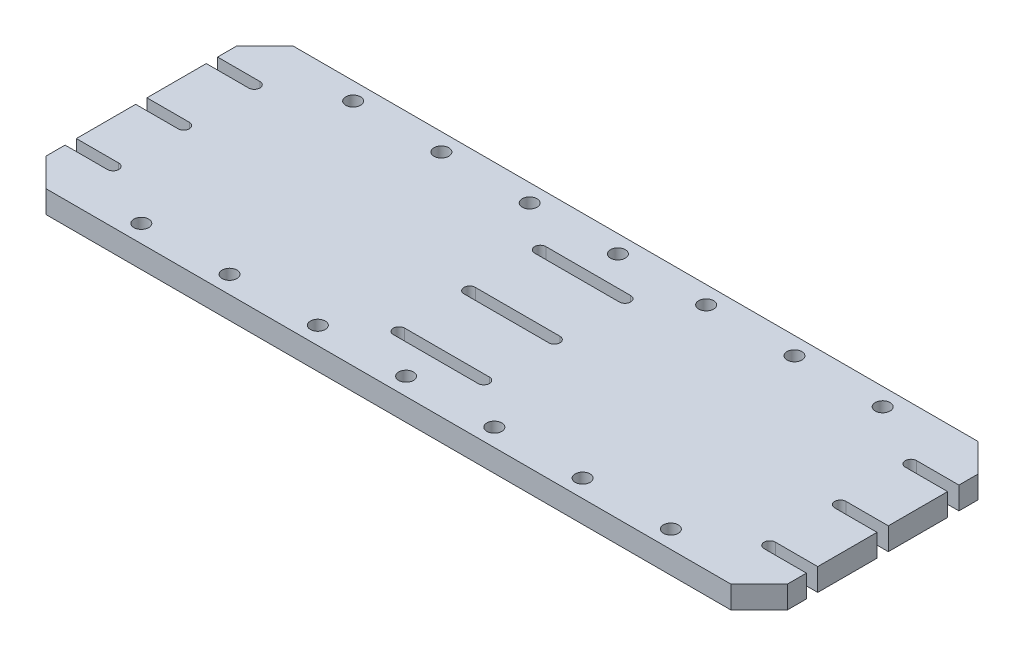
from build123d import *

# Parameters (mm, degrees)
SKETCH1_W                   = 210
SKETCH1_H                   = 70
BOSS_EXTRUDE1_DEPTH         = 6.35
CUT_EXTRUDE1_DEPTH          = 111.861726939
LPATTERN1_COUNT             = 4
LPATTERN1_PITCH             = 20
LPATTERN1_COUNT_DIR2        = 4
LPATTERN1_PITCH_DIR2        = 20
LPATTERN2_COUNT             = 2
LPATTERN2_PITCH             = 105
LPATTERN2_COPY_1_DEPTH      = 111.861726939
LPATTERN2_COPY_2_DEPTH      = 111.861726939
LPATTERN2_COPY_3_DEPTH      = 111.861726939
LPATTERN2_COPY_4_DEPTH      = 111.861726939
LPATTERN2_COPY_5_DEPTH      = 111.861726939
LPATTERN2_COPY_6_DEPTH      = 111.861726939
LPATTERN2_COPY_7_DEPTH      = 111.861726939
LPATTERN2_COPY_8_DEPTH      = 111.861726939
LPATTERN2_COPY_9_DEPTH      = 111.861726939
LPATTERN2_COPY_10_DEPTH     = 111.861726939
LPATTERN2_COPY_11_DEPTH     = 111.861726939
LPATTERN2_COPY_12_DEPTH     = 111.861726939
LPATTERN2_COPY_13_DEPTH     = 111.861726939
LPATTERN2_COPY_14_DEPTH     = 111.861726939
LPATTERN2_COPY_15_DEPTH     = 111.861726939
LPATTERN2_COL_COUNT         = 2
LPATTERN2_COL_PITCH         = 105
LPATTERN2_COL_COPY_1_DEPTH  = 111.861726939
LPATTERN2_COL_COPY_2_DEPTH  = 111.861726939
LPATTERN2_COL_COPY_3_DEPTH  = 111.861726939
LPATTERN2_COL_COPY_4_DEPTH  = 111.861726939
LPATTERN2_COL_COPY_5_DEPTH  = 111.861726939
LPATTERN2_COL_COPY_6_DEPTH  = 111.861726939
LPATTERN2_COL_COPY_7_DEPTH  = 111.861726939
LPATTERN2_COL_COPY_8_DEPTH  = 111.861726939
LPATTERN2_COL_COPY_9_DEPTH  = 111.861726939
LPATTERN2_COL_COPY_10_DEPTH = 111.861726939
LPATTERN2_COL_COPY_11_DEPTH = 111.861726939
LPATTERN2_COL_COPY_12_DEPTH = 111.861726939
LPATTERN2_COL_COPY_13_DEPTH = 111.861726939
LPATTERN2_COL_COPY_14_DEPTH = 111.861726939
LPATTERN2_COL_COPY_15_DEPTH = 111.861726939
SKETCH4_R                   = 2.1
CUT_EXTRUDE2_DEPTH          = 111.861726939
LPATTERN3_COUNT             = 4
LPATTERN3_PITCH             = 25
LPATTERN3_COL_COUNT         = 4
LPATTERN3_COL_PITCH         = 25
CHAMFER1_SIZE               = 8


with BuildPart() as part:
    # Sketch1 → Boss-Extrude1 (new body)
    with BuildSketch(Plane(origin=(0, 0, 0), x_dir=(1, 0, 0), z_dir=(0, 1, 0))):
        Rectangle(SKETCH1_W, SKETCH1_H)
    extrude(amount=BOSS_EXTRUDE1_DEPTH)

    # Sketch3 → Cut-Extrude1 (cut, symmetric)
    with BuildSketch(Plane(origin=(0, 6.35, 0), x_dir=(1, 0, 0), z_dir=(0, 1, 0))):
        with BuildLine():
            Line((12, -1.6), (-12, -1.6))
            ThreePointArc((-12, -1.6), (-13.6, 0), (-12, 1.6))
            Line((-12, 1.6), (12, 1.6))
            ThreePointArc((12, 1.6), (13.6, 0), (12, -1.6))
        make_face()
    cut_extrude1 = extrude(amount=CUT_EXTRUDE1_DEPTH, both=True, mode=Mode.SUBTRACT)

    # LPattern1: Cut-Extrude1 4 × 4
    with Locations(*[Vector(0, 0, 1) * (i * LPATTERN1_PITCH) + Vector(0, 0, -1) * (j * LPATTERN1_PITCH_DIR2) for i in range(LPATTERN1_COUNT) for j in range(LPATTERN1_COUNT_DIR2) if (i, j) != (0, 0)]):
        add(cut_extrude1, mode=Mode.SUBTRACT)

    # LPattern2: Cut-Extrude1 ×2
    with Locations(*[(i * LPATTERN2_PITCH, 0, 0) for i in range(1, LPATTERN2_COUNT)]):
        add(cut_extrude1, mode=Mode.SUBTRACT)

    # LPattern2 copy 1 sketch → LPattern2 copy 1 (cut, symmetric)
    with BuildSketch(Plane(origin=(105, 6.35, -20), x_dir=(1, 0, 0), z_dir=(0, 1, 0))):
        with BuildLine():
            Line((12, -1.6), (-12, -1.6))
            ThreePointArc((-12, -1.6), (-13.6, 0), (-12, 1.6))
            Line((-12, 1.6), (12, 1.6))
            ThreePointArc((12, 1.6), (13.6, 0), (12, -1.6))
        make_face()
    extrude(amount=LPATTERN2_COPY_1_DEPTH, both=True, mode=Mode.SUBTRACT)

    # LPattern2 copy 2 sketch → LPattern2 copy 2 (cut, symmetric)
    with BuildSketch(Plane(origin=(105, 6.35, -40), x_dir=(1, 0, 0), z_dir=(0, 1, 0))):
        with BuildLine():
            Line((12, -1.6), (-12, -1.6))
            ThreePointArc((-12, -1.6), (-13.6, 0), (-12, 1.6))
            Line((-12, 1.6), (12, 1.6))
            ThreePointArc((12, 1.6), (13.6, 0), (12, -1.6))
        make_face()
    extrude(amount=LPATTERN2_COPY_2_DEPTH, both=True, mode=Mode.SUBTRACT)

    # LPattern2 copy 3 sketch → LPattern2 copy 3 (cut, symmetric)
    with BuildSketch(Plane(origin=(105, 6.35, -60), x_dir=(1, 0, 0), z_dir=(0, 1, 0))):
        with BuildLine():
            Line((12, -1.6), (-12, -1.6))
            ThreePointArc((-12, -1.6), (-13.6, 0), (-12, 1.6))
            Line((-12, 1.6), (12, 1.6))
            ThreePointArc((12, 1.6), (13.6, 0), (12, -1.6))
        make_face()
    extrude(amount=LPATTERN2_COPY_3_DEPTH, both=True, mode=Mode.SUBTRACT)

    # LPattern2 copy 4 sketch → LPattern2 copy 4 (cut, symmetric)
    with BuildSketch(Plane(origin=(105, 6.35, 20), x_dir=(1, 0, 0), z_dir=(0, 1, 0))):
        with BuildLine():
            Line((12, -1.6), (-12, -1.6))
            ThreePointArc((-12, -1.6), (-13.6, 0), (-12, 1.6))
            Line((-12, 1.6), (12, 1.6))
            ThreePointArc((12, 1.6), (13.6, 0), (12, -1.6))
        make_face()
    extrude(amount=LPATTERN2_COPY_4_DEPTH, both=True, mode=Mode.SUBTRACT)

    # LPattern2 copy 5 sketch → LPattern2 copy 5 (cut, symmetric)
    with BuildSketch(Plane(origin=(105, 6.35, 0), x_dir=(1, 0, 0), z_dir=(0, 1, 0))):
        with BuildLine():
            Line((12, -1.6), (-12, -1.6))
            ThreePointArc((-12, -1.6), (-13.6, 0), (-12, 1.6))
            Line((-12, 1.6), (12, 1.6))
            ThreePointArc((12, 1.6), (13.6, 0), (12, -1.6))
        make_face()
    extrude(amount=LPATTERN2_COPY_5_DEPTH, both=True, mode=Mode.SUBTRACT)

    # LPattern2 copy 6 sketch → LPattern2 copy 6 (cut, symmetric)
    with BuildSketch(Plane(origin=(105, 6.35, -20), x_dir=(1, 0, 0), z_dir=(0, 1, 0))):
        with BuildLine():
            Line((12, -1.6), (-12, -1.6))
            ThreePointArc((-12, -1.6), (-13.6, 0), (-12, 1.6))
            Line((-12, 1.6), (12, 1.6))
            ThreePointArc((12, 1.6), (13.6, 0), (12, -1.6))
        make_face()
    extrude(amount=LPATTERN2_COPY_6_DEPTH, both=True, mode=Mode.SUBTRACT)

    # LPattern2 copy 7 sketch → LPattern2 copy 7 (cut, symmetric)
    with BuildSketch(Plane(origin=(105, 6.35, -40), x_dir=(1, 0, 0), z_dir=(0, 1, 0))):
        with BuildLine():
            Line((12, -1.6), (-12, -1.6))
            ThreePointArc((-12, -1.6), (-13.6, 0), (-12, 1.6))
            Line((-12, 1.6), (12, 1.6))
            ThreePointArc((12, 1.6), (13.6, 0), (12, -1.6))
        make_face()
    extrude(amount=LPATTERN2_COPY_7_DEPTH, both=True, mode=Mode.SUBTRACT)

    # LPattern2 copy 8 sketch → LPattern2 copy 8 (cut, symmetric)
    with BuildSketch(Plane(origin=(105, 6.35, 40), x_dir=(1, 0, 0), z_dir=(0, 1, 0))):
        with BuildLine():
            Line((12, -1.6), (-12, -1.6))
            ThreePointArc((-12, -1.6), (-13.6, 0), (-12, 1.6))
            Line((-12, 1.6), (12, 1.6))
            ThreePointArc((12, 1.6), (13.6, 0), (12, -1.6))
        make_face()
    extrude(amount=LPATTERN2_COPY_8_DEPTH, both=True, mode=Mode.SUBTRACT)

    # LPattern2 copy 9 sketch → LPattern2 copy 9 (cut, symmetric)
    with BuildSketch(Plane(origin=(105, 6.35, 20), x_dir=(1, 0, 0), z_dir=(0, 1, 0))):
        with BuildLine():
            Line((12, -1.6), (-12, -1.6))
            ThreePointArc((-12, -1.6), (-13.6, 0), (-12, 1.6))
            Line((-12, 1.6), (12, 1.6))
            ThreePointArc((12, 1.6), (13.6, 0), (12, -1.6))
        make_face()
    extrude(amount=LPATTERN2_COPY_9_DEPTH, both=True, mode=Mode.SUBTRACT)

    # LPattern2 copy 10 sketch → LPattern2 copy 10 (cut, symmetric)
    with BuildSketch(Plane(origin=(105, 6.35, 0), x_dir=(1, 0, 0), z_dir=(0, 1, 0))):
        with BuildLine():
            Line((12, -1.6), (-12, -1.6))
            ThreePointArc((-12, -1.6), (-13.6, 0), (-12, 1.6))
            Line((-12, 1.6), (12, 1.6))
            ThreePointArc((12, 1.6), (13.6, 0), (12, -1.6))
        make_face()
    extrude(amount=LPATTERN2_COPY_10_DEPTH, both=True, mode=Mode.SUBTRACT)

    # LPattern2 copy 11 sketch → LPattern2 copy 11 (cut, symmetric)
    with BuildSketch(Plane(origin=(105, 6.35, -20), x_dir=(1, 0, 0), z_dir=(0, 1, 0))):
        with BuildLine():
            Line((12, -1.6), (-12, -1.6))
            ThreePointArc((-12, -1.6), (-13.6, 0), (-12, 1.6))
            Line((-12, 1.6), (12, 1.6))
            ThreePointArc((12, 1.6), (13.6, 0), (12, -1.6))
        make_face()
    extrude(amount=LPATTERN2_COPY_11_DEPTH, both=True, mode=Mode.SUBTRACT)

    # LPattern2 copy 12 sketch → LPattern2 copy 12 (cut, symmetric)
    with BuildSketch(Plane(origin=(105, 6.35, 60), x_dir=(1, 0, 0), z_dir=(0, 1, 0))):
        with BuildLine():
            Line((12, -1.6), (-12, -1.6))
            ThreePointArc((-12, -1.6), (-13.6, 0), (-12, 1.6))
            Line((-12, 1.6), (12, 1.6))
            ThreePointArc((12, 1.6), (13.6, 0), (12, -1.6))
        make_face()
    extrude(amount=LPATTERN2_COPY_12_DEPTH, both=True, mode=Mode.SUBTRACT)

    # LPattern2 copy 13 sketch → LPattern2 copy 13 (cut, symmetric)
    with BuildSketch(Plane(origin=(105, 6.35, 40), x_dir=(1, 0, 0), z_dir=(0, 1, 0))):
        with BuildLine():
            Line((12, -1.6), (-12, -1.6))
            ThreePointArc((-12, -1.6), (-13.6, 0), (-12, 1.6))
            Line((-12, 1.6), (12, 1.6))
            ThreePointArc((12, 1.6), (13.6, 0), (12, -1.6))
        make_face()
    extrude(amount=LPATTERN2_COPY_13_DEPTH, both=True, mode=Mode.SUBTRACT)

    # LPattern2 copy 14 sketch → LPattern2 copy 14 (cut, symmetric)
    with BuildSketch(Plane(origin=(105, 6.35, 20), x_dir=(1, 0, 0), z_dir=(0, 1, 0))):
        with BuildLine():
            Line((12, -1.6), (-12, -1.6))
            ThreePointArc((-12, -1.6), (-13.6, 0), (-12, 1.6))
            Line((-12, 1.6), (12, 1.6))
            ThreePointArc((12, 1.6), (13.6, 0), (12, -1.6))
        make_face()
    extrude(amount=LPATTERN2_COPY_14_DEPTH, both=True, mode=Mode.SUBTRACT)

    # LPattern2 copy 15 sketch → LPattern2 copy 15 (cut, symmetric)
    with BuildSketch(Plane(origin=(105, 6.35, 0), x_dir=(1, 0, 0), z_dir=(0, 1, 0))):
        with BuildLine():
            Line((12, -1.6), (-12, -1.6))
            ThreePointArc((-12, -1.6), (-13.6, 0), (-12, 1.6))
            Line((-12, 1.6), (12, 1.6))
            ThreePointArc((12, 1.6), (13.6, 0), (12, -1.6))
        make_face()
    extrude(amount=LPATTERN2_COPY_15_DEPTH, both=True, mode=Mode.SUBTRACT)

    # LPattern2 col: Cut-Extrude1 ×2
    with Locations(*[(-i * LPATTERN2_COL_PITCH, 0, 0) for i in range(1, LPATTERN2_COL_COUNT)]):
        add(cut_extrude1, mode=Mode.SUBTRACT)

    # LPattern2 col copy 1 sketch → LPattern2 col copy 1 (cut, symmetric)
    with BuildSketch(Plane(origin=(-105, 6.35, -20), x_dir=(1, 0, 0), z_dir=(0, 1, 0))):
        with BuildLine():
            Line((12, -1.6), (-12, -1.6))
            ThreePointArc((-12, -1.6), (-13.6, 0), (-12, 1.6))
            Line((-12, 1.6), (12, 1.6))
            ThreePointArc((12, 1.6), (13.6, 0), (12, -1.6))
        make_face()
    extrude(amount=LPATTERN2_COL_COPY_1_DEPTH, both=True, mode=Mode.SUBTRACT)

    # LPattern2 col copy 2 sketch → LPattern2 col copy 2 (cut, symmetric)
    with BuildSketch(Plane(origin=(-105, 6.35, -40), x_dir=(1, 0, 0), z_dir=(0, 1, 0))):
        with BuildLine():
            Line((12, -1.6), (-12, -1.6))
            ThreePointArc((-12, -1.6), (-13.6, 0), (-12, 1.6))
            Line((-12, 1.6), (12, 1.6))
            ThreePointArc((12, 1.6), (13.6, 0), (12, -1.6))
        make_face()
    extrude(amount=LPATTERN2_COL_COPY_2_DEPTH, both=True, mode=Mode.SUBTRACT)

    # LPattern2 col copy 3 sketch → LPattern2 col copy 3 (cut, symmetric)
    with BuildSketch(Plane(origin=(-105, 6.35, -60), x_dir=(1, 0, 0), z_dir=(0, 1, 0))):
        with BuildLine():
            Line((12, -1.6), (-12, -1.6))
            ThreePointArc((-12, -1.6), (-13.6, 0), (-12, 1.6))
            Line((-12, 1.6), (12, 1.6))
            ThreePointArc((12, 1.6), (13.6, 0), (12, -1.6))
        make_face()
    extrude(amount=LPATTERN2_COL_COPY_3_DEPTH, both=True, mode=Mode.SUBTRACT)

    # LPattern2 col copy 4 sketch → LPattern2 col copy 4 (cut, symmetric)
    with BuildSketch(Plane(origin=(-105, 6.35, 20), x_dir=(1, 0, 0), z_dir=(0, 1, 0))):
        with BuildLine():
            Line((12, -1.6), (-12, -1.6))
            ThreePointArc((-12, -1.6), (-13.6, 0), (-12, 1.6))
            Line((-12, 1.6), (12, 1.6))
            ThreePointArc((12, 1.6), (13.6, 0), (12, -1.6))
        make_face()
    extrude(amount=LPATTERN2_COL_COPY_4_DEPTH, both=True, mode=Mode.SUBTRACT)

    # LPattern2 col copy 5 sketch → LPattern2 col copy 5 (cut, symmetric)
    with BuildSketch(Plane(origin=(-105, 6.35, 0), x_dir=(1, 0, 0), z_dir=(0, 1, 0))):
        with BuildLine():
            Line((12, -1.6), (-12, -1.6))
            ThreePointArc((-12, -1.6), (-13.6, 0), (-12, 1.6))
            Line((-12, 1.6), (12, 1.6))
            ThreePointArc((12, 1.6), (13.6, 0), (12, -1.6))
        make_face()
    extrude(amount=LPATTERN2_COL_COPY_5_DEPTH, both=True, mode=Mode.SUBTRACT)

    # LPattern2 col copy 6 sketch → LPattern2 col copy 6 (cut, symmetric)
    with BuildSketch(Plane(origin=(-105, 6.35, -20), x_dir=(1, 0, 0), z_dir=(0, 1, 0))):
        with BuildLine():
            Line((12, -1.6), (-12, -1.6))
            ThreePointArc((-12, -1.6), (-13.6, 0), (-12, 1.6))
            Line((-12, 1.6), (12, 1.6))
            ThreePointArc((12, 1.6), (13.6, 0), (12, -1.6))
        make_face()
    extrude(amount=LPATTERN2_COL_COPY_6_DEPTH, both=True, mode=Mode.SUBTRACT)

    # LPattern2 col copy 7 sketch → LPattern2 col copy 7 (cut, symmetric)
    with BuildSketch(Plane(origin=(-105, 6.35, -40), x_dir=(1, 0, 0), z_dir=(0, 1, 0))):
        with BuildLine():
            Line((12, -1.6), (-12, -1.6))
            ThreePointArc((-12, -1.6), (-13.6, 0), (-12, 1.6))
            Line((-12, 1.6), (12, 1.6))
            ThreePointArc((12, 1.6), (13.6, 0), (12, -1.6))
        make_face()
    extrude(amount=LPATTERN2_COL_COPY_7_DEPTH, both=True, mode=Mode.SUBTRACT)

    # LPattern2 col copy 8 sketch → LPattern2 col copy 8 (cut, symmetric)
    with BuildSketch(Plane(origin=(-105, 6.35, 40), x_dir=(1, 0, 0), z_dir=(0, 1, 0))):
        with BuildLine():
            Line((12, -1.6), (-12, -1.6))
            ThreePointArc((-12, -1.6), (-13.6, 0), (-12, 1.6))
            Line((-12, 1.6), (12, 1.6))
            ThreePointArc((12, 1.6), (13.6, 0), (12, -1.6))
        make_face()
    extrude(amount=LPATTERN2_COL_COPY_8_DEPTH, both=True, mode=Mode.SUBTRACT)

    # LPattern2 col copy 9 sketch → LPattern2 col copy 9 (cut, symmetric)
    with BuildSketch(Plane(origin=(-105, 6.35, 20), x_dir=(1, 0, 0), z_dir=(0, 1, 0))):
        with BuildLine():
            Line((12, -1.6), (-12, -1.6))
            ThreePointArc((-12, -1.6), (-13.6, 0), (-12, 1.6))
            Line((-12, 1.6), (12, 1.6))
            ThreePointArc((12, 1.6), (13.6, 0), (12, -1.6))
        make_face()
    extrude(amount=LPATTERN2_COL_COPY_9_DEPTH, both=True, mode=Mode.SUBTRACT)

    # LPattern2 col copy 10 sketch → LPattern2 col copy 10 (cut, symmetric)
    with BuildSketch(Plane(origin=(-105, 6.35, 0), x_dir=(1, 0, 0), z_dir=(0, 1, 0))):
        with BuildLine():
            Line((12, -1.6), (-12, -1.6))
            ThreePointArc((-12, -1.6), (-13.6, 0), (-12, 1.6))
            Line((-12, 1.6), (12, 1.6))
            ThreePointArc((12, 1.6), (13.6, 0), (12, -1.6))
        make_face()
    extrude(amount=LPATTERN2_COL_COPY_10_DEPTH, both=True, mode=Mode.SUBTRACT)

    # LPattern2 col copy 11 sketch → LPattern2 col copy 11 (cut, symmetric)
    with BuildSketch(Plane(origin=(-105, 6.35, -20), x_dir=(1, 0, 0), z_dir=(0, 1, 0))):
        with BuildLine():
            Line((12, -1.6), (-12, -1.6))
            ThreePointArc((-12, -1.6), (-13.6, 0), (-12, 1.6))
            Line((-12, 1.6), (12, 1.6))
            ThreePointArc((12, 1.6), (13.6, 0), (12, -1.6))
        make_face()
    extrude(amount=LPATTERN2_COL_COPY_11_DEPTH, both=True, mode=Mode.SUBTRACT)

    # LPattern2 col copy 12 sketch → LPattern2 col copy 12 (cut, symmetric)
    with BuildSketch(Plane(origin=(-105, 6.35, 60), x_dir=(1, 0, 0), z_dir=(0, 1, 0))):
        with BuildLine():
            Line((12, -1.6), (-12, -1.6))
            ThreePointArc((-12, -1.6), (-13.6, 0), (-12, 1.6))
            Line((-12, 1.6), (12, 1.6))
            ThreePointArc((12, 1.6), (13.6, 0), (12, -1.6))
        make_face()
    extrude(amount=LPATTERN2_COL_COPY_12_DEPTH, both=True, mode=Mode.SUBTRACT)

    # LPattern2 col copy 13 sketch → LPattern2 col copy 13 (cut, symmetric)
    with BuildSketch(Plane(origin=(-105, 6.35, 40), x_dir=(1, 0, 0), z_dir=(0, 1, 0))):
        with BuildLine():
            Line((12, -1.6), (-12, -1.6))
            ThreePointArc((-12, -1.6), (-13.6, 0), (-12, 1.6))
            Line((-12, 1.6), (12, 1.6))
            ThreePointArc((12, 1.6), (13.6, 0), (12, -1.6))
        make_face()
    extrude(amount=LPATTERN2_COL_COPY_13_DEPTH, both=True, mode=Mode.SUBTRACT)

    # LPattern2 col copy 14 sketch → LPattern2 col copy 14 (cut, symmetric)
    with BuildSketch(Plane(origin=(-105, 6.35, 20), x_dir=(1, 0, 0), z_dir=(0, 1, 0))):
        with BuildLine():
            Line((12, -1.6), (-12, -1.6))
            ThreePointArc((-12, -1.6), (-13.6, 0), (-12, 1.6))
            Line((-12, 1.6), (12, 1.6))
            ThreePointArc((12, 1.6), (13.6, 0), (12, -1.6))
        make_face()
    extrude(amount=LPATTERN2_COL_COPY_14_DEPTH, both=True, mode=Mode.SUBTRACT)

    # LPattern2 col copy 15 sketch → LPattern2 col copy 15 (cut, symmetric)
    with BuildSketch(Plane(origin=(-105, 6.35, 0), x_dir=(1, 0, 0), z_dir=(0, 1, 0))):
        with BuildLine():
            Line((12, -1.6), (-12, -1.6))
            ThreePointArc((-12, -1.6), (-13.6, 0), (-12, 1.6))
            Line((-12, 1.6), (12, 1.6))
            ThreePointArc((12, 1.6), (13.6, 0), (12, -1.6))
        make_face()
    extrude(amount=LPATTERN2_COL_COPY_15_DEPTH, both=True, mode=Mode.SUBTRACT)

    # Sketch4 → Cut-Extrude2 (cut, symmetric)
    with BuildSketch(Plane(origin=(0, 6.35, 0), x_dir=(1, 0, 0), z_dir=(0, 1, 0))):
        with Locations(Location((0, 30, 0), (0, 0, 270))):
            Circle(SKETCH4_R)
        with Locations(Location((0, -30, 0), (0, 0, 270))):
            Circle(SKETCH4_R)
        with Locations((0, 50)):
            Circle(SKETCH4_R)
        with Locations((0, -50)):
            Circle(SKETCH4_R)
    cut_extrude2 = extrude(amount=CUT_EXTRUDE2_DEPTH, both=True, mode=Mode.SUBTRACT)

    # LPattern3: Cut-Extrude2 ×4
    with Locations(*[(i * LPATTERN3_PITCH, 0, 0) for i in range(1, LPATTERN3_COUNT)]):
        add(cut_extrude2, mode=Mode.SUBTRACT)

    # LPattern3 col: Cut-Extrude2 ×4
    with Locations(*[(-i * LPATTERN3_COL_PITCH, 0, 0) for i in range(1, LPATTERN3_COL_COUNT)]):
        add(cut_extrude2, mode=Mode.SUBTRACT)

    # Chamfer1
    chamfer1_edges = [part.edges().sort_by_distance(p)[0] for p in [
        (-105, 3.175, -35),
        (105, 3.175, -35),
        (105, 3.175, 35),
        (-105, 3.175, 35),
    ]]
    chamfer(chamfer1_edges, length=CHAMFER1_SIZE)


solid = part.part
